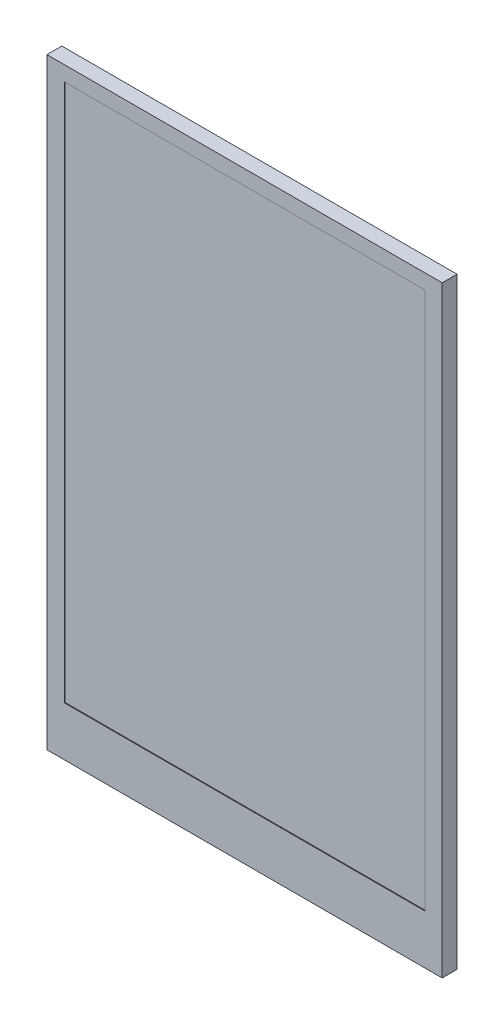
from build123d import *

# Parameters (mm, degrees)
SKETCH_1_W          = 54.46
SKETCH_1_H          = 82.94
EXTRUDE_1_DEPTH     = 2.05
SKETCH_2_W          = 49.66
SKETCH_2_H          = 74.09
CUT_EXTRUDE_1_DEPTH = 0.1
EXTRUDE_3_DEPTH     = 30
SKETCH_8_W          = 6.614912747
SKETCH_8_H          = 12.711315131
SKETCH_8_W_2        = 7.688185389
SKETCH_8_H_2        = 12.692983113
SKETCH_8_W_3        = 6.978944135
SKETCH_8_H_3        = 8.940227215
SKETCH_8_W_4        = 7.775121352
CUT_EXTRUDE_4_DEPTH = 30


with BuildPart() as part:
    # 草图1 → 凸台-拉伸1 (new body)
    with BuildSketch(Plane.XY):
        Rectangle(SKETCH_1_W, SKETCH_1_H)
    extrude(amount=EXTRUDE_1_DEPTH)

    # 草图2 → 切除-拉伸1 (cut)
    with BuildSketch(Plane.XY.offset(2.05)):
        with Locations((0, 2.375)):
            Rectangle(SKETCH_2_W, SKETCH_2_H)
    extrude(amount=-CUT_EXTRUDE_1_DEPTH, mode=Mode.SUBTRACT)


with BuildPart() as body_2:
    # 草图7 → 凸台-拉伸3 (new body)
    with BuildSketch(Plane(origin=(18, 0, 0), x_dir=(0, 0, -1), z_dir=(1, 0, 0))):
        with BuildLine():
            Line((5.146552874, -3.47), (5.444020563, -3.431103035))
            add(Edge.make_bspline(
                [(-1.286297274, -41.617389736), (-1.223587325, -41.728563955), (-1.088033939, -41.954770225), (-0.827169864, -42.33511155), (-0.496595202, -42.721851198), (-0.096719678, -43.043667166), (0.449458325, -43.298879387), (1.140273171, -43.257430936), (1.739673196, -42.77212046), (2.112797921, -42.08995031), (2.283153908, -41.305573434), (2.196921491, -40.525373684), (1.919357435, -39.854162671), (1.578844311, -39.240339327), (1.173173818, -38.460506981), (0.802886094, -37.450137111), (0.605911538, -36.21752602), (0.60041949, -34.517551684), (0.943173643, -32.30751937), (1.37059894, -30.023283722), (1.520340398, -28.162909769), (1.45720112, -26.305484226), (1.118605039, -24.032494684), (0.716583543, -21.378403338), (0.739095108, -18.845877941), (1.503065232, -16.357755368), (2.638046298, -13.868210623), (3.77755363, -11.385375623), (4.741808939, -8.874044395), (5.343749283, -6.69224251), (5.545946119, -4.86546684), (5.505533179, -3.901525747), (5.444020563, -3.431103035)],
                knots=[0, 0, 0, 0, 0.00390625, 0.0078125, 0.015625, 0.0234375, 0.03125, 0.046875, 0.0625, 0.078125, 0.09375, 0.109375, 0.125, 0.140625, 0.15625, 0.1875, 0.21875, 0.25, 0.3125, 0.375, 0.40625, 0.4375, 0.5, 0.5625, 0.625, 0.6875, 0.75, 0.8125, 0.875, 0.9375, 0.96875, 1, 1, 1, 1], degree=3))
            Line((-1.286297274, -41.617389736), (-1.025, -41.47))
            add(Edge.make_bspline(
                [(-1.025, -41.47), (0.586135687, -44.326273264), (2.724437043, -41.577020469), (1.167092054, -39.243034526), (-0.474291884, -35.137676384), (2.41314287, -28.253237542), (-0.609973253, -19.940727833), (2.604118731, -13.342042381), (4.761345707, -8.325901773), (5.344389343, -4.982970422), (5.146552874, -3.47)],
                knots=[0, 0, 0, 0, 0.099779567, 0.147390068, 0.187617053, 0.406024613, 0.616638529, 0.763830123, 0.898120838, 1, 1, 1, 1], degree=3))
        make_face()
    extrude(amount=-EXTRUDE_3_DEPTH)

    # 草图8 → 切除-拉伸4 (cut)
    with BuildSketch(Plane(origin=(0, 0, 0), x_dir=(-1, 0, 0), z_dir=(0, 0, -1))):
        with Locations((-14.692543627, -9.768428583)):
            Rectangle(SKETCH_8_W, SKETCH_8_H)
        with Locations((8.155907305, -9.777594591)):
            Rectangle(SKETCH_8_W_2, SKETCH_8_H_2)
        with Locations((8.510527933, -38.396276724)):
            Rectangle(SKETCH_8_W_3, SKETCH_8_H_3)
        with Locations((-14.112439324, -38.396276724)):
            Rectangle(SKETCH_8_W_4, SKETCH_8_H_3)
    extrude(amount=CUT_EXTRUDE_4_DEPTH, mode=Mode.SUBTRACT)


solid = Compound([part.part, body_2.part])
